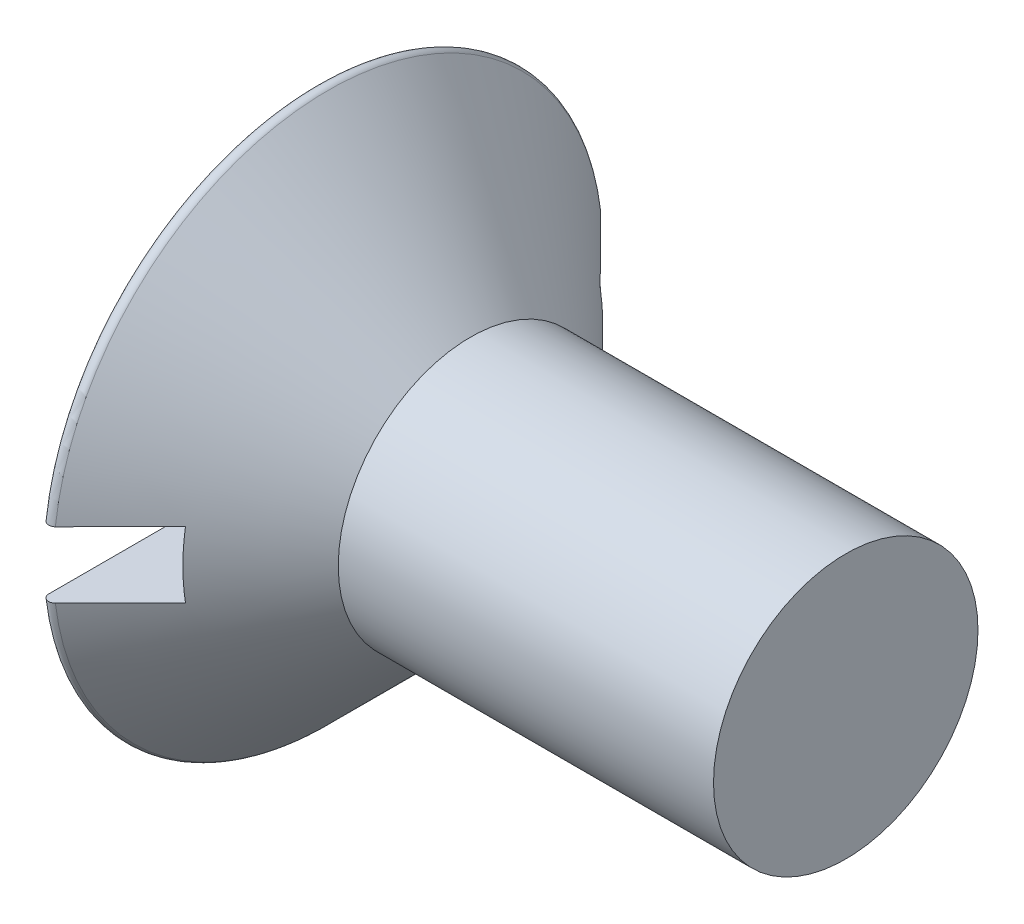
from build123d import *

# Parameters (mm, degrees)
HEADFILLET_R     = 0.2
NOTCH_DEPTH      = 20.900217222
NOTCH_DEPTH_BACK = 20.900217222
SKETCH2_W        = 2.3
SKETCH2_H        = 2


with BuildPart() as part:
    # Sketch1 → Base (revolve)
    with BuildSketch(Plane.XY, mode=Mode.PRIVATE) as base_sk:
        Polygon((0, 0), (0, 8.65), (4.65, 4), (16, 4), (16, 0), align=None)
    revolve(base_sk.sketch.rotate(Axis((-5.569640847, 0, 0), (1, 0, 0)), 90), axis=Axis((-5.569640847, 0, 0), (1, 0, 0)))

    # HeadFillet
    headfillet_edges = [part.edges().sort_by_distance(p)[0] for p in [
        (0, 0, -8.65),
    ]]
    fillet(headfillet_edges, radius=HEADFILLET_R)

    # Sketch2 → Notch (cut, two sides: drawn at the far end of the back side and taken through both)
    with BuildSketch(Plane.XY.offset(-NOTCH_DEPTH_BACK)):
        with Locations((1.15, 0)):
            Rectangle(SKETCH2_W, SKETCH2_H)
    extrude(amount=NOTCH_DEPTH + NOTCH_DEPTH_BACK, mode=Mode.SUBTRACT)


solid = part.part
